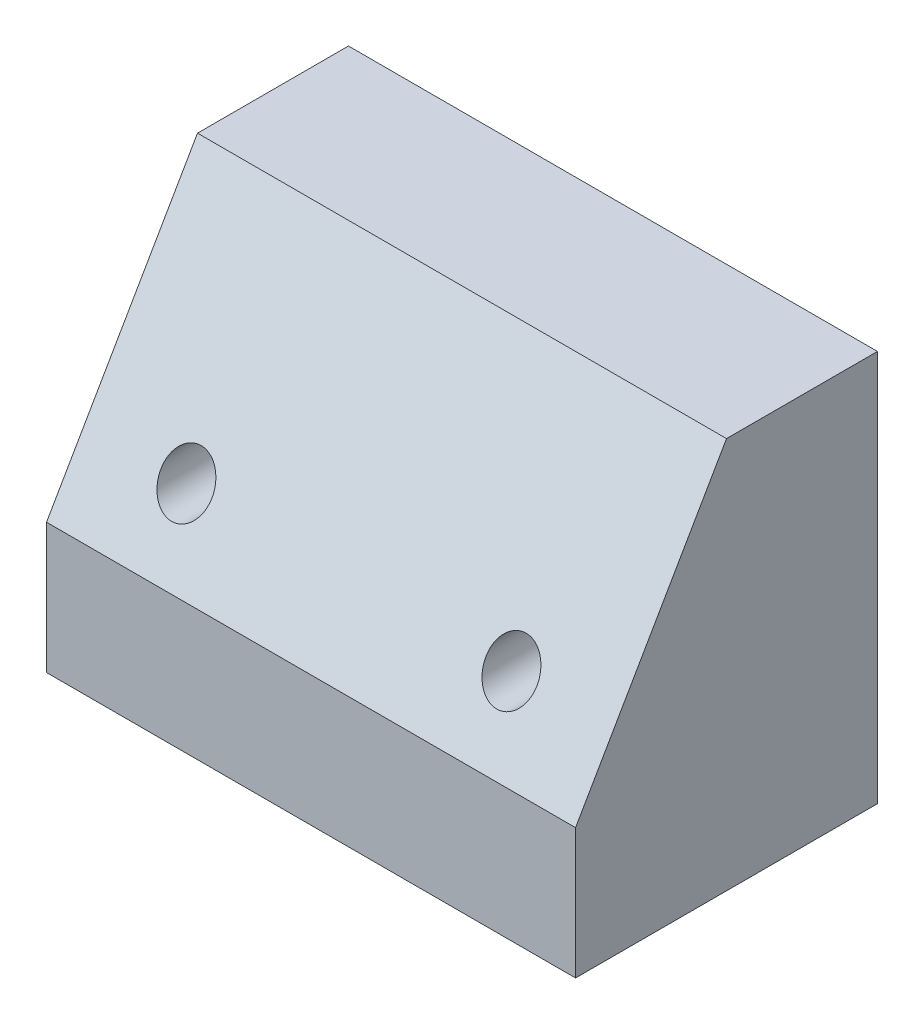
from build123d import *

# Parameters (mm, degrees)
SKIZZE1_W                                           = 155.6
SKIZZE1_H                                           = 115.2
AUFSATZ_LINEAR_AUSTRAGEN1_DEPTH                     = 88.8
STIRNSENKUNG_F_R_M8_SENKSCHRAUBE_KOPF_B_D           = 9
STIRNSENKUNG_F_R_M8_SENKSCHRAUBE_KOPF_B_CBORE_D     = 15
STIRNSENKUNG_F_R_M8_SENKSCHRAUBE_KOPF_B_CBORE_DEPTH = 80
SCHNITT_LINEAR_AUSTRAGEN1_DEPTH                     = 189.187566008


with BuildPart() as part:
    # Skizze1 → Aufsatz-Linear austragen1 (new body)
    with BuildSketch(Plane.XY):
        Rectangle(SKIZZE1_W, SKIZZE1_H)
    extrude(amount=AUFSATZ_LINEAR_AUSTRAGEN1_DEPTH)

    # Stirnsenkung für M8 Senkschraube (Kopf Button)1 (through all)
    with Locations(Plane.XY.offset(88.8)):
        with Locations((-47.8, 0)):
            stirnsenkung_f_r_m8_senkschraube_kopf_b = CounterBoreHole(STIRNSENKUNG_F_R_M8_SENKSCHRAUBE_KOPF_B_D / 2, STIRNSENKUNG_F_R_M8_SENKSCHRAUBE_KOPF_B_CBORE_D / 2, STIRNSENKUNG_F_R_M8_SENKSCHRAUBE_KOPF_B_CBORE_DEPTH)

    # Spiegeln1: Stirnsenkung für M8 Senkschraube (Kopf Button)1 across plane
    add(stirnsenkung_f_r_m8_senkschraube_kopf_b.mirror(Plane(origin=(0, 0, 0), x_dir=(0, 0, 1), z_dir=(1, 0, 0))), mode=Mode.SUBTRACT)

    # Skizze6 → Schnitt-Linear austragen1 (cut, through all)
    with BuildSketch(Plane.ZY.offset(77.8)):
        Polygon((44.4, 57.6), (88.8, -19.303055856), (88.8, 57.6), align=None)
    extrude(amount=-SCHNITT_LINEAR_AUSTRAGEN1_DEPTH, mode=Mode.SUBTRACT)


solid = part.part
